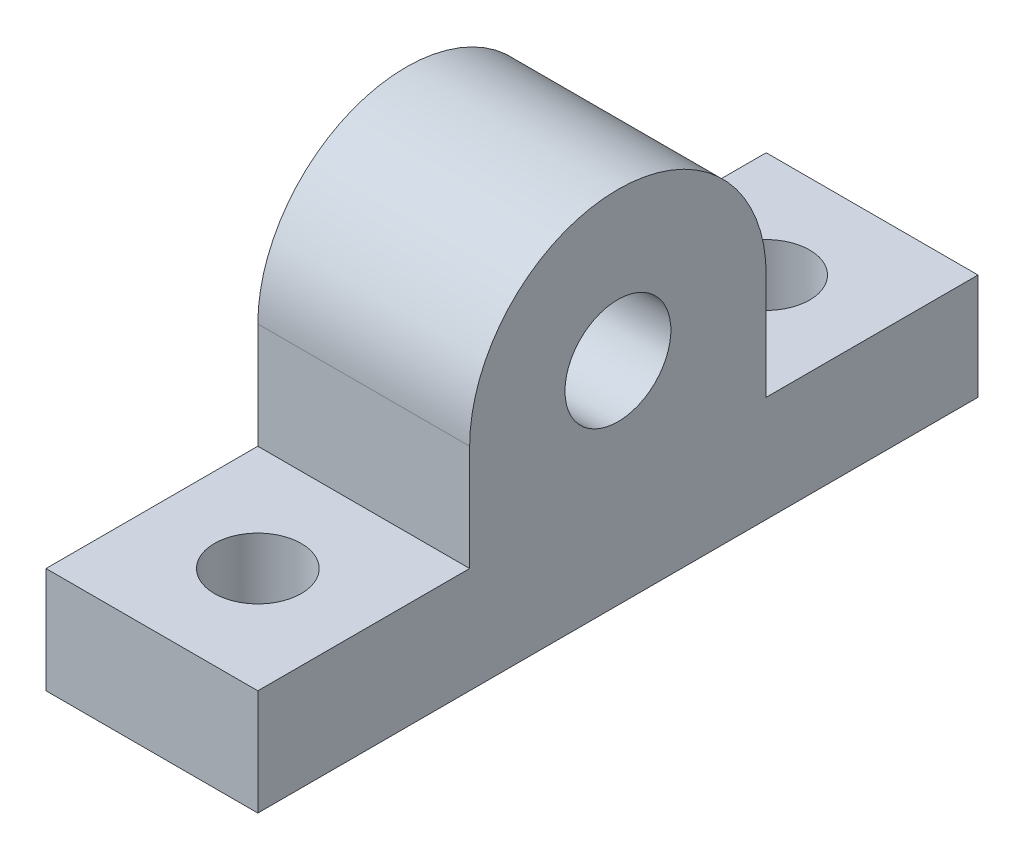
from build123d import *

# Parameters (mm, degrees)
ESQUISSE1_R                  = 2.5
BOSS_EXTRU_1_DEPTH           = 10
ENL_V_MAT_EXTRU_1_DEPTH      = 24.086792761
ENL_V_MAT_EXTRU_1_DEPTH_BACK = 24.086792761
ESQUISSE2_R                  = 2.05


with BuildPart() as part:
    # Esquisse1 → Boss.-Extru.1 (new body)
    with BuildSketch(Plane(origin=(0, 0, 0), x_dir=(0, 0, -1), z_dir=(1, 0, 0))):
        with BuildLine():
            Line((17, 0), (-17, 0))
            Line((-17, 0), (-17, 5))
            Line((-17, 5), (-7, 5))
            Line((-7, 5), (-7, 10))
            ThreePointArc((-7, 10), (0, 17), (7, 10))
            Line((7, 10), (7, 5))
            Line((7, 5), (17, 5))
            Line((17, 5), (17, 0))
        make_face()
        with Locations(Location((0, 10, 0), (0, 0, 180))):
            Circle(ESQUISSE1_R, mode=Mode.SUBTRACT)
    extrude(amount=BOSS_EXTRU_1_DEPTH)

    # Esquisse2 → Enlèv. mat.-Extru.1 (cut, two sides: drawn at the far end of the back side and taken through both)
    with BuildSketch(Plane(origin=(0, 5, 0), x_dir=(1, 0, 0), z_dir=(0, 1, 0)).offset(-ENL_V_MAT_EXTRU_1_DEPTH_BACK)):
        with Locations(Location((5, 12, 0), (0, 0, 270))):
            Circle(ESQUISSE2_R)
        with Locations(Location((5, -12, 0), (0, 0, 270))):
            Circle(ESQUISSE2_R)
    extrude(amount=ENL_V_MAT_EXTRU_1_DEPTH + ENL_V_MAT_EXTRU_1_DEPTH_BACK, mode=Mode.SUBTRACT)


solid = part.part
